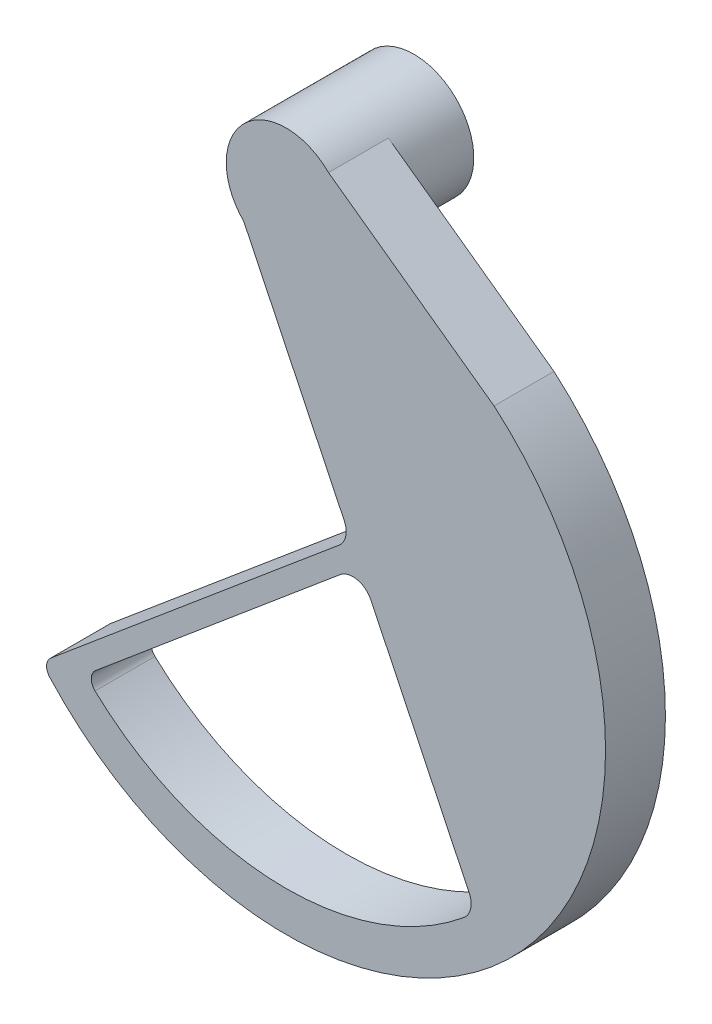
from build123d import *

# Parameters (mm, degrees)
EXTRUDE_1_DEPTH     = 15
EXTRUDE_START       = 17
SKETCH_9_R          = 15
EXTRUDE_3_DEPTH     = 17
SKETCH_10_R         = 10.1
CUT_EXTRUDE_4_DEPTH = 2


with BuildPart() as part:
    # ｽｹｯﾁ4 → ﾎﾞｽ - 押し出し1 (new body)
    with BuildSketch(Plane.XY):
        with BuildLine():
            Line((-53.623111018, -124.995132678), (-58.940636287, -129.45706617))
            ThreePointArc((-58.940636287, -129.45706617), (-60.005384698, -131.552012131), (-59.233530865, -133.771635843))
            ThreePointArc((-59.233530865, -133.771635843), (57.362306223, -135.763481103), (52.076178918, -19.270504783))
            Line((52.076178918, -19.270504783), (10.606601718, 10.606601718))
            ThreePointArc((10.606601718, 10.606601718), (-10.606601718, 10.606601718), (-10.606601718, -10.606601718))
            Line((-10.606601718, -10.606601718), (14.536280154, -62.889638219))
            ThreePointArc((14.536280154, -62.889638219), (14.918089499, -66.109676181), (13.244185189, -68.886809092))
            Line((13.244185189, -68.886809092), (-53.623111018, -124.995132678))
        make_face()
        with BuildLine():
            Line((21.232400696, -76.813798404), (45.844843506, -127.993820346))
            ThreePointArc((45.844843506, -127.993820346), (46.221944165, -131.235480845), (44.518718993, -134.019289696))
            ThreePointArc((44.518718993, -134.019289696), (-2.231208213, -149.964431749), (-47.870174388, -131.072951785))
            ThreePointArc((-47.870174388, -131.072951785), (-48.817477846, -128.802229421), (-47.747678417, -126.586582094))
            Line((-47.747678417, -126.586582094), (13.511229465, -75.151532228))
            ThreePointArc((13.511229465, -75.151532228), (17.77869109, -74.092739753), (21.232400696, -76.813798404))
        make_face(mode=Mode.SUBTRACT)
    extrude(amount=EXTRUDE_1_DEPTH)

    # ｽｹｯﾁ9 → ﾎﾞｽ - 押し出し3 (add)
    with BuildSketch(Plane(origin=(0, 0, 0), x_dir=(-1, 0, 0), z_dir=(0, 0, -1)).offset(EXTRUDE_START)):
        Circle(SKETCH_9_R)
    extrude(amount=-EXTRUDE_3_DEPTH)

    # ｽｹｯﾁ10 → ｶｯﾄ - 押し出し4 (cut)
    with BuildSketch(Plane(origin=(0, 0, -17), x_dir=(-1, 0, 0), z_dir=(0, 0, -1))):
        Circle(SKETCH_10_R)
    extrude(amount=-CUT_EXTRUDE_4_DEPTH, mode=Mode.SUBTRACT)


solid = part.part
